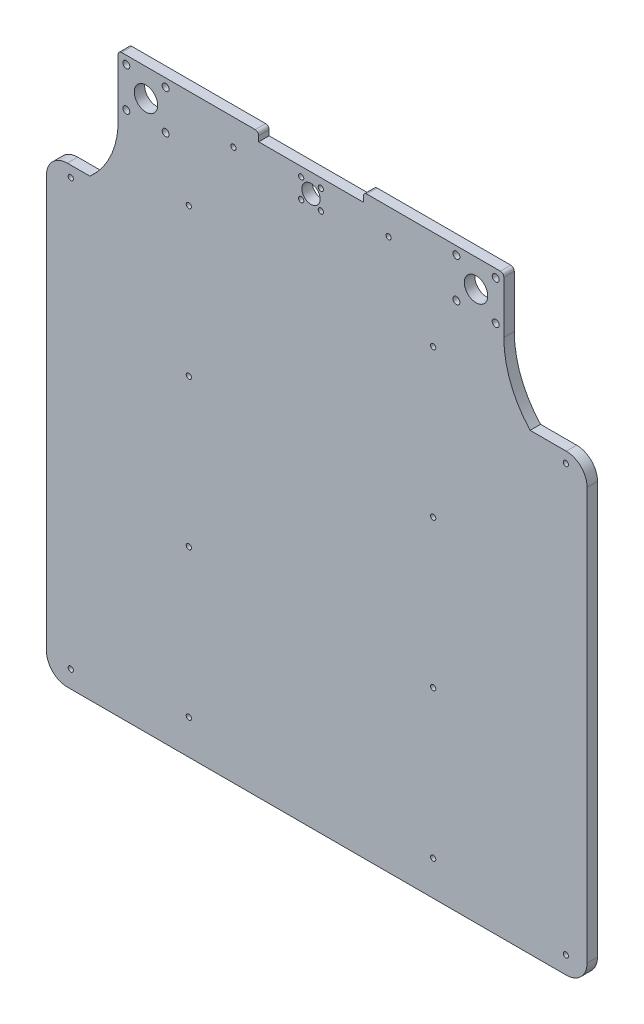
from build123d import *

# Parameters (mm, degrees)
CROQUIS1_R              = 1.5
CROQUIS1_R_2            = 2
CROQUIS1_R_3            = 6.75
CROQUIS1_R_4            = 5.25
SALIENTE_EXTRUIR1_DEPTH = 6


with BuildPart() as part:
    # Croquis1 → Saliente-Extruir1 (new body)
    with BuildSketch(Plane.XY):
        with BuildLine():
            Line((87.635637669, 16), (32.115377174, 16))
            ThreePointArc((32.115377174, 16), (30.701163612, 15.414213562), (30.115377174, 14))
            Line((30.115377174, 14), (30.115377174, 10.910010016))
            Line((30.115377174, 10.910010016), (-30.115377174, 10.910010016))
            Line((-30.115377174, 10.910010016), (-30.115377174, 14))
            ThreePointArc((-30.115377174, 14), (-30.701163612, 15.414213562), (-32.115377174, 16))
            Line((-32.115377174, 16), (-44.664398505, 16))
            Line((-44.664398505, 16), (-87.635637669, 16))
            Line((-87.635637669, 16), (-109, 16))
            ThreePointArc((-109, 16), (-110.414213562, 15.414213562), (-111, 14))
            Line((-111, 14), (-111, 0))
            Line((-111, 0), (-111, -16))
            Line((-111, -16), (-111, -16.087517131))
            ThreePointArc((-111, -16.087517131), (-114.684754838, -37.311709927), (-127.277573278, -54.789258433))
            Line((-127.277573278, -54.789258433), (-135.277573278, -54.789258433))
            Line((-135.277573278, -54.789258433), (-140.277573278, -54.789258433))
            ThreePointArc((-140.277573278, -54.789258433), (-148.762854653, -58.303977059), (-152.277573278, -66.789258433))
            Line((-152.277573278, -66.789258433), (-152.277573278, -304))
            ThreePointArc((-152.277573278, -304), (-148.762854653, -312.485281374), (-140.277573278, -316))
            Line((-140.277573278, -316), (-135.277573278, -316))
            Line((-135.277573278, -316), (-119.364295205, -316))
            Line((-119.364295205, -316), (-96, -316))
            Line((-96, -316), (-44.664398505, -316))
            Line((-44.664398505, -316), (119.364429455, -316))
            Line((119.364429455, -316), (130.295105026, -316))
            Line((130.295105026, -316), (146.942872896, -316))
            ThreePointArc((146.942872896, -316), (155.42815427, -312.485281374), (158.942872896, -304))
            Line((158.942872896, -304), (158.942872896, -70.858545673))
            Line((158.942872896, -70.858545673), (158.942872896, -66.789258433))
            ThreePointArc((158.942872896, -66.789258433), (155.42815427, -58.303977059), (146.942872896, -54.789258433))
            Line((146.942872896, -54.789258433), (126.134028278, -54.789258433))
            ThreePointArc((126.134028278, -54.789258433), (114.918041875, -36.865291264), (111, -16.087517131))
            Line((111, -16.087517131), (111, 14))
            ThreePointArc((111, 14), (110.414213562, 15.414213562), (109, 16))
            Line((109, 16), (87.635637669, 16))
        make_face()
        with Locations((-138.277573278, -306)):
            Circle(CROQUIS1_R, mode=Mode.SUBTRACT)
        with Locations((-70.332132128, -296)):
            Circle(CROQUIS1_R, mode=Mode.SUBTRACT)
        with Locations((-70.332132128, -211)):
            Circle(CROQUIS1_R, mode=Mode.SUBTRACT)
        with Locations((70.332132128, -296)):
            Circle(CROQUIS1_R, mode=Mode.SUBTRACT)
        with Locations((146.722426722, -306)):
            Circle(CROQUIS1_R, mode=Mode.SUBTRACT)
        with Locations((70.332132128, -211)):
            Circle(CROQUIS1_R, mode=Mode.SUBTRACT)
        with Locations((-70.332132128, -126)):
            Circle(CROQUIS1_R, mode=Mode.SUBTRACT)
        with Locations((-138.277573278, -61)):
            Circle(CROQUIS1_R, mode=Mode.SUBTRACT)
        with Locations((-106.313708499, -11.313708499)):
            Circle(CROQUIS1_R_2, mode=Mode.SUBTRACT)
        with Locations((-83.686291501, -11.313708499)):
            Circle(CROQUIS1_R_2, mode=Mode.SUBTRACT)
        with Locations((-95, 0)):
            Circle(CROQUIS1_R_3, mode=Mode.SUBTRACT)
        with Locations((-106.313708499, 11.313708499)):
            Circle(CROQUIS1_R_2, mode=Mode.SUBTRACT)
        with Locations((-83.686291501, 11.313708499)):
            Circle(CROQUIS1_R_2, mode=Mode.SUBTRACT)
        with Locations((-70.332132128, -41)):
            Circle(CROQUIS1_R, mode=Mode.SUBTRACT)
        with Locations((-44.664398505, 1)):
            Circle(CROQUIS1_R, mode=Mode.SUBTRACT)
        with Locations((-5.656854249, -5.656854249)):
            Circle(CROQUIS1_R, mode=Mode.SUBTRACT)
        Circle(CROQUIS1_R_4, mode=Mode.SUBTRACT)
        with Locations((-5.656854249, 5.656854249)):
            Circle(CROQUIS1_R, mode=Mode.SUBTRACT)
        with Locations((70.332132128, -126)):
            Circle(CROQUIS1_R, mode=Mode.SUBTRACT)
        with Locations((70.332132128, -41)):
            Circle(CROQUIS1_R, mode=Mode.SUBTRACT)
        with Locations((5.656854249, -5.656854249)):
            Circle(CROQUIS1_R, mode=Mode.SUBTRACT)
        with Locations((5.656854249, 5.656854249)):
            Circle(CROQUIS1_R, mode=Mode.SUBTRACT)
        with Locations((44.664398505, 1)):
            Circle(CROQUIS1_R, mode=Mode.SUBTRACT)
        with Locations((146.722426722, -61)):
            Circle(CROQUIS1_R, mode=Mode.SUBTRACT)
        with Locations((83.686291501, -11.313708499)):
            Circle(CROQUIS1_R_2, mode=Mode.SUBTRACT)
        with Locations((106.313708499, -11.313708499)):
            Circle(CROQUIS1_R_2, mode=Mode.SUBTRACT)
        with Locations((95, 0)):
            Circle(CROQUIS1_R_3, mode=Mode.SUBTRACT)
        with Locations((83.686291501, 11.313708499)):
            Circle(CROQUIS1_R_2, mode=Mode.SUBTRACT)
        with Locations((106.313708499, 11.313708499)):
            Circle(CROQUIS1_R_2, mode=Mode.SUBTRACT)
    extrude(amount=SALIENTE_EXTRUIR1_DEPTH)


solid = part.part
